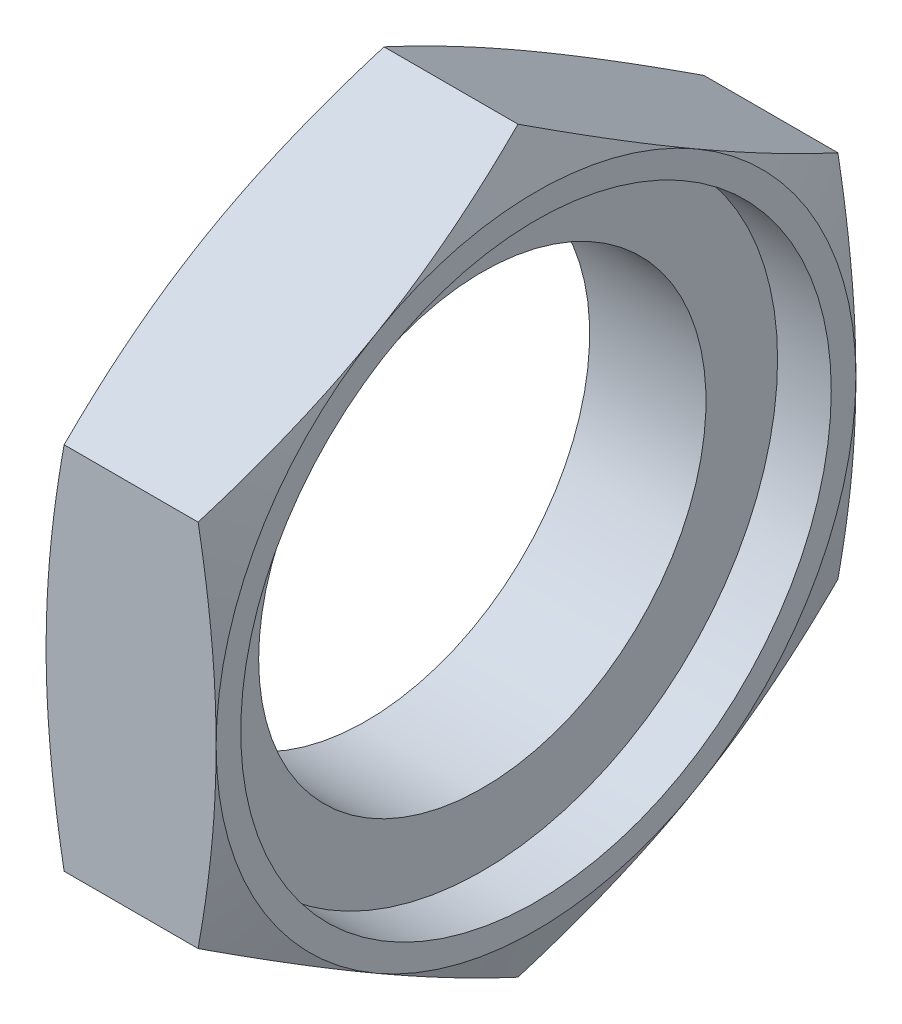
from build123d import *

# Parameters (mm, degrees)
ESBO_O1_R                = 10
RESSALTO_EXTRUS_O1_DEPTH = 7.6
FURO1_D                  = 26.4
FURO1_DEPTH              = 2.4
ESBO_O7_OUTSIDE_W        = 110.904
ESBO_O7_OUTSIDE_H        = 115.328
ESBO_O7_OUTSIDE_R        = 14.3
CORTE_EXTRUS_O1_DEPTH    = 13
CORTE_EXTRUS_O1_DRAFT    = -70
ESBO_O8_OUTSIDE_W        = 110.904
ESBO_O8_OUTSIDE_H        = 115.328
ESBO_O8_OUTSIDE_R        = 14.3
CORTE_EXTRUS_O2_DEPTH    = 13
CORTE_EXTRUS_O2_DRAFT    = -70


with BuildPart() as part:
    # Esboço1 → Ressalto-extrusão1 (new body)
    with BuildSketch(Plane(origin=(0, 0, 0), x_dir=(0, 0, -1), z_dir=(1, 0, 0))):
        Polygon((14.3, 8.256108849), (0, 16.512217699), (-14.3, 8.256108849), (-14.3, -8.256108849), (0, -16.512217699), (14.3, -8.256108849), align=None)
        with Locations(Location((0, 0, 0), (0, 0, 180))):
            Circle(ESBO_O1_R, mode=Mode.SUBTRACT)
    extrude(amount=RESSALTO_EXTRUS_O1_DEPTH)

    # Furo1
    with Locations(Plane(origin=(7.6, 0, 0), x_dir=(0, 0, -1), z_dir=(1, 0, 0))):
        with Locations((0, 0)):
            Hole(FURO1_D / 2, depth=FURO1_DEPTH)


with BuildPart() as corte_extrus_o1_tool:
    # Esboço7 outside → Corte-extrusão1 (with draft: the straight prism first)
    with BuildSketch(Plane(origin=(7.6, 0, 0), x_dir=(0, 0, -1), z_dir=(1, 0, 0))):
        Rectangle(ESBO_O7_OUTSIDE_W, ESBO_O7_OUTSIDE_H)
        Circle(ESBO_O7_OUTSIDE_R, mode=Mode.SUBTRACT)
    extrude(amount=-CORTE_EXTRUS_O1_DEPTH)
    # Corte-extrusão1: the draft: its side faces are tilted about the plane it starts from
    corte_extrus_o1_sides = [corte_extrus_o1_tool.faces().sort_by_distance(p)[0] for p in [
        (1.1, -57.664, 0),
        (1.1, 0, -55.452),
        (1.1, 57.664, 0),
        (1.1, 0, 55.452),
        (1.1, 0, 14.3),
    ]]
    draft(corte_extrus_o1_sides, Plane(origin=(7.6, 0, 0), x_dir=(0, 0, -1), z_dir=(1, 0, 0)), CORTE_EXTRUS_O1_DRAFT)


with BuildPart() as part_1:
    add(part.part)

    # Corte-extrusão1: cut by corte_extrus_o1_tool
    add(corte_extrus_o1_tool.part, mode=Mode.SUBTRACT)


with BuildPart() as corte_extrus_o2_tool:
    # Esboço8 outside → Corte-extrusão2 (with draft: the straight prism first)
    with BuildSketch(Plane.ZY):
        Rectangle(ESBO_O8_OUTSIDE_W, ESBO_O8_OUTSIDE_H)
        Circle(ESBO_O8_OUTSIDE_R, mode=Mode.SUBTRACT)
    extrude(amount=-CORTE_EXTRUS_O2_DEPTH)
    # Corte-extrusão2: the draft: its side faces are tilted about the plane it starts from
    corte_extrus_o2_sides = [corte_extrus_o2_tool.faces().sort_by_distance(p)[0] for p in [
        (6.5, -57.664, 0),
        (6.5, 0, 55.452),
        (6.5, 57.664, 0),
        (6.5, 0, -55.452),
        (6.5, 0, -14.3),
    ]]
    draft(corte_extrus_o2_sides, Plane.ZY, CORTE_EXTRUS_O2_DRAFT)


with BuildPart() as part_2:
    add(part_1.part)

    # Corte-extrusão2: cut by corte_extrus_o2_tool
    add(corte_extrus_o2_tool.part, mode=Mode.SUBTRACT)


solid = part_2.part
